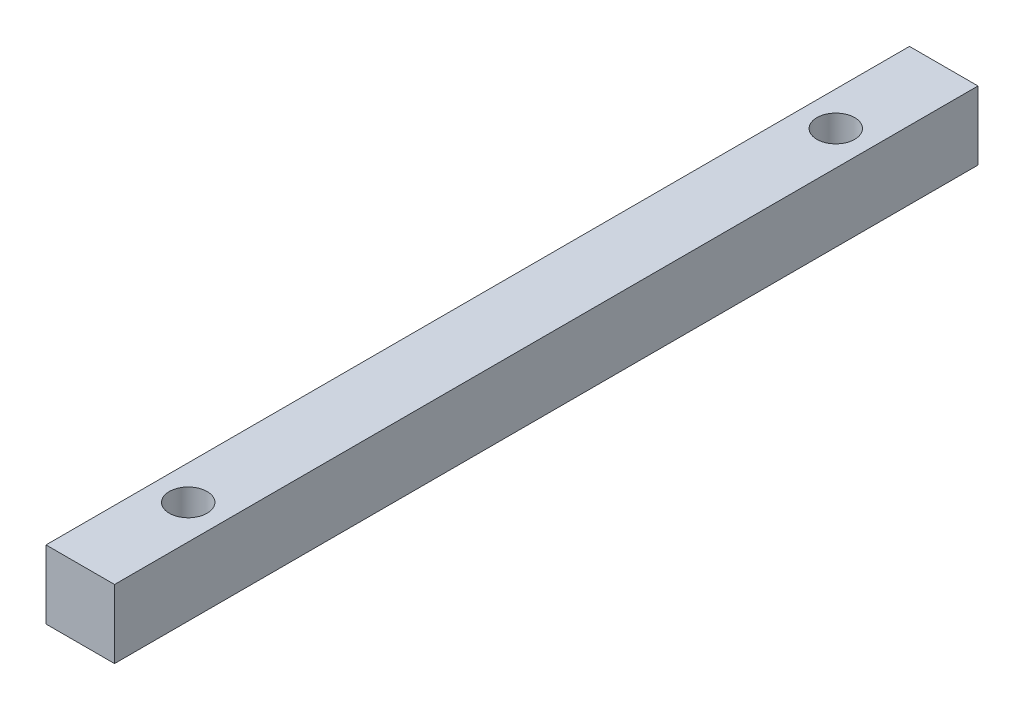
from build123d import *

# Parameters (mm, degrees)
BOSS_EXTRUDE1_DEPTH      = 609.6
BOSS_EXTRUDE1_DEPTH_BACK = 609.6
SKETCH3_W                = 6.35
SKETCH3_H                = 6.35
SKETCH4_W                = 7.35
SKETCH4_H                = 7.35
CUT_EXTRUDE1_DEPTH       = 1140.208848829
SKETCH5_R                = 1.75
CUT_EXTRUDE2_DEPTH       = 610.641339744


with BuildPart() as part:
    # Sketch3 → Boss-Extrude1 (new, two sides: drawn at the far end of the back side and taken through both)
    with BuildSketch(Plane.XY.offset(-BOSS_EXTRUDE1_DEPTH_BACK)):
        Rectangle(SKETCH3_W, SKETCH3_H)
    extrude(amount=BOSS_EXTRUDE1_DEPTH + BOSS_EXTRUDE1_DEPTH_BACK)

    # Sketch4 → Cut-Extrude1 (cut, through all)
    with BuildSketch(Plane(origin=(0, 0, -529.6), x_dir=(-1, 0, 0), z_dir=(0, 0, -1))):
        Rectangle(SKETCH4_W, SKETCH4_H)
    extrude(amount=-CUT_EXTRUDE1_DEPTH, mode=Mode.SUBTRACT)

    # Sketch5 → Cut-Extrude2 (cut, through all)
    with BuildSketch(Plane(origin=(0, 3.175, 0), x_dir=(1, 0, 0), z_dir=(0, 1, 0))):
        with Locations(Location((0, 599.6, 0), (0, 0, 270))):
            Circle(SKETCH5_R)
        with Locations(Location((0, 539.6, 0), (0, 0, 270))):
            Circle(SKETCH5_R)
    extrude(amount=-CUT_EXTRUDE2_DEPTH, mode=Mode.SUBTRACT)


solid = part.part
